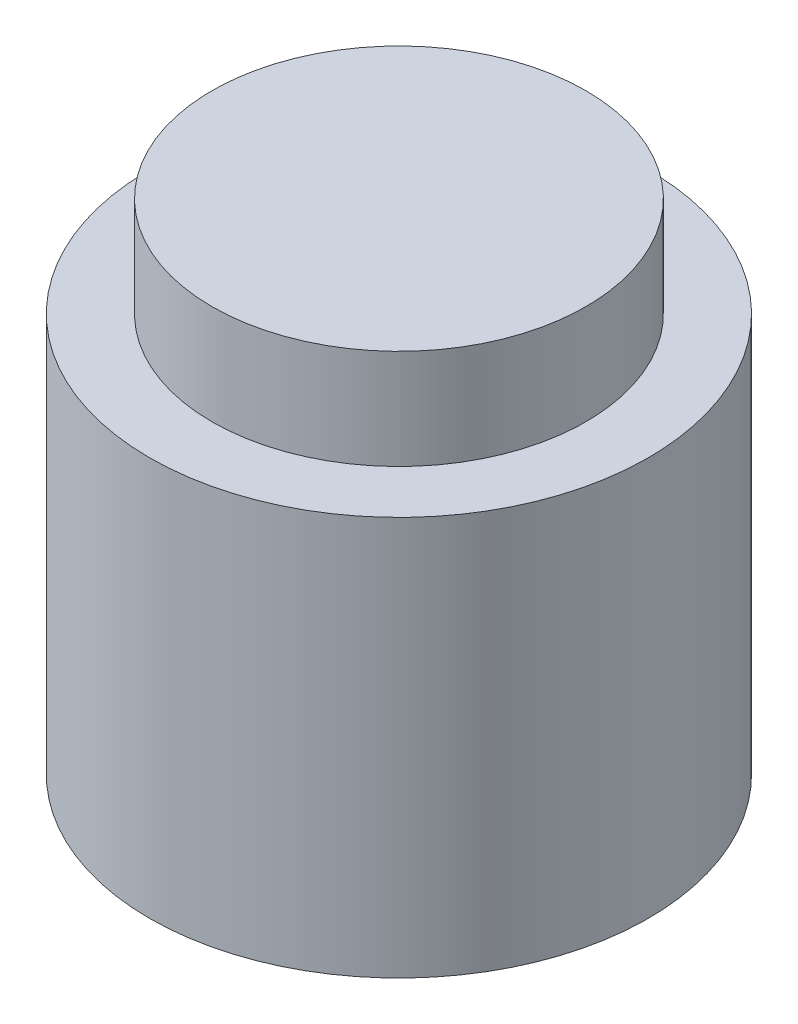
from build123d import *

# Parameters (mm, degrees)
SKETCH1_R           = 5
SKETCH1_R_2         = 3
BOSS_EXTRUDE1_DEPTH = 6
SKETCH5_R           = 5
BOSS_EXTRUDE5_DEPTH = 2
SKETCH7_R           = 3.75
BOSS_EXTRUDE6_DEPTH = 2


with BuildPart() as part:
    # Sketch1 → Boss-Extrude1 (new body)
    # profile 1 of 3: a face of its own
    with BuildSketch(Plane(origin=(0, 0, 0), x_dir=(1, 0, 0), z_dir=(0, 1, 0))):
        with Locations(Location((0, 0, 0), (0, 0, 270))):
            Circle(SKETCH1_R)
        Circle(SKETCH1_R_2, mode=Mode.SUBTRACT)
    # profile 2 of 3: a face of its own
    with BuildSketch(Plane(origin=(0, 0, 0), x_dir=(1, 0, 0), z_dir=(0, 1, 0))):
        with BuildLine():
            Line((2.436698586, -1.75), (-2.436698586, -1.75))
            ThreePointArc((-2.436698586, -1.75), (0, -3), (2.436698586, -1.75))
        make_face()
    # profile 3 of 3: a face of its own
    with BuildSketch(Plane(origin=(0, 0, 0), x_dir=(1, 0, 0), z_dir=(0, 1, 0))):
        with BuildLine():
            ThreePointArc((2.436698586, 1.75), (0, 3), (-2.436698586, 1.75))
            Line((-2.436698586, 1.75), (2.436698586, 1.75))
        make_face()
    extrude(amount=BOSS_EXTRUDE1_DEPTH)

    # Sketch5 → Boss-Extrude5 (add)
    with BuildSketch(Plane(origin=(0, 6, 0), x_dir=(1, 0, 0), z_dir=(0, 1, 0))):
        with Locations(Location((0, 0, 0), (0, 0, 270))):
            Circle(SKETCH5_R)
    extrude(amount=BOSS_EXTRUDE5_DEPTH)

    # Sketch7 → Boss-Extrude6 (add)
    with BuildSketch(Plane(origin=(0, 8, 0), x_dir=(1, 0, 0), z_dir=(0, 1, 0))):
        with Locations(Location((0, 0, 0), (0, 0, 270))):
            Circle(SKETCH7_R)
    extrude(amount=BOSS_EXTRUDE6_DEPTH)


solid = part.part
